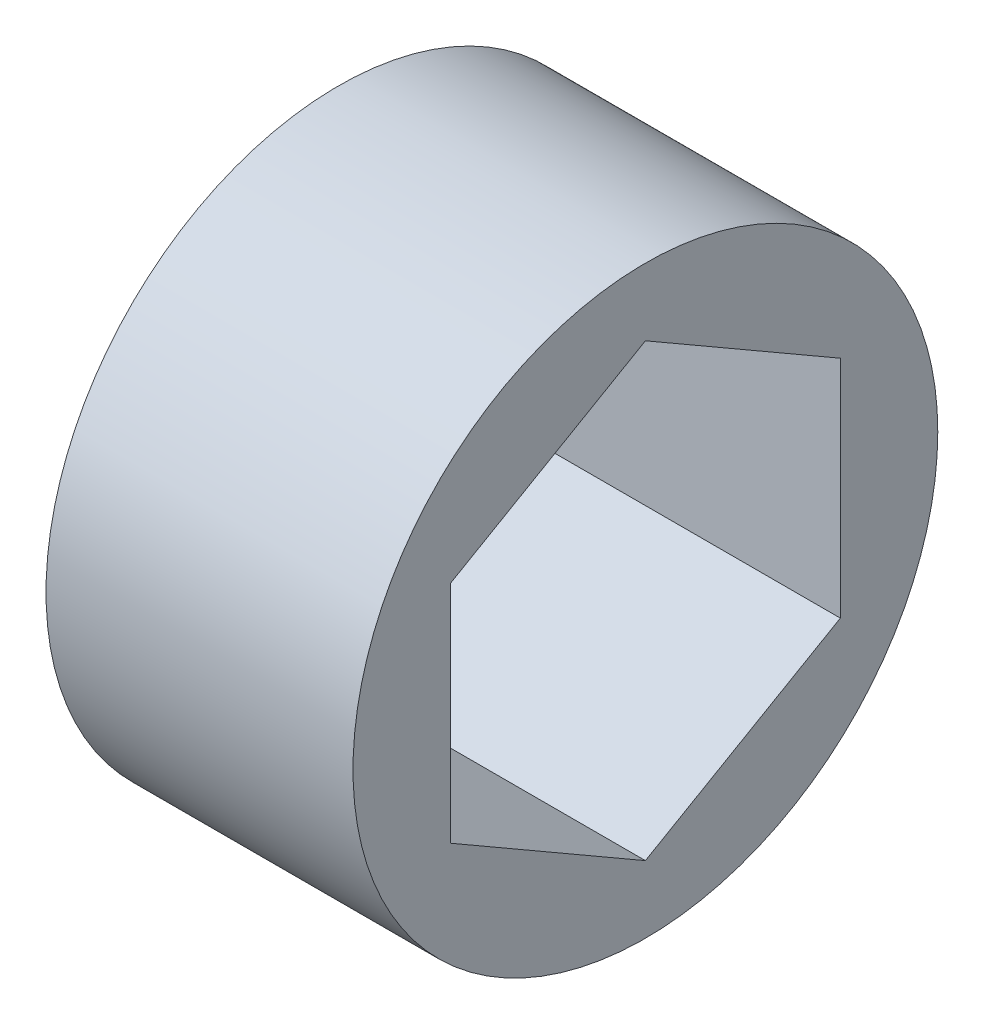
from build123d import *

# Parameters (mm, degrees)
SKETCH1_R           = 9.525
BOSS_EXTRUDE1_DEPTH = 10


with BuildPart() as part:
    # Sketch1 → Boss-Extrude1 (new body)
    with BuildSketch(Plane(origin=(0, 0, 0), x_dir=(0, 0, -1), z_dir=(1, 0, 0))):
        Circle(SKETCH1_R)
        Polygon((0, 7.332348419), (-6.35, 3.666174209), (-6.35, -3.666174209), (0, -7.332348419), (6.35, -3.666174209), (6.35, 3.666174209), align=None, mode=Mode.SUBTRACT)
    extrude(amount=BOSS_EXTRUDE1_DEPTH)


solid = part.part
